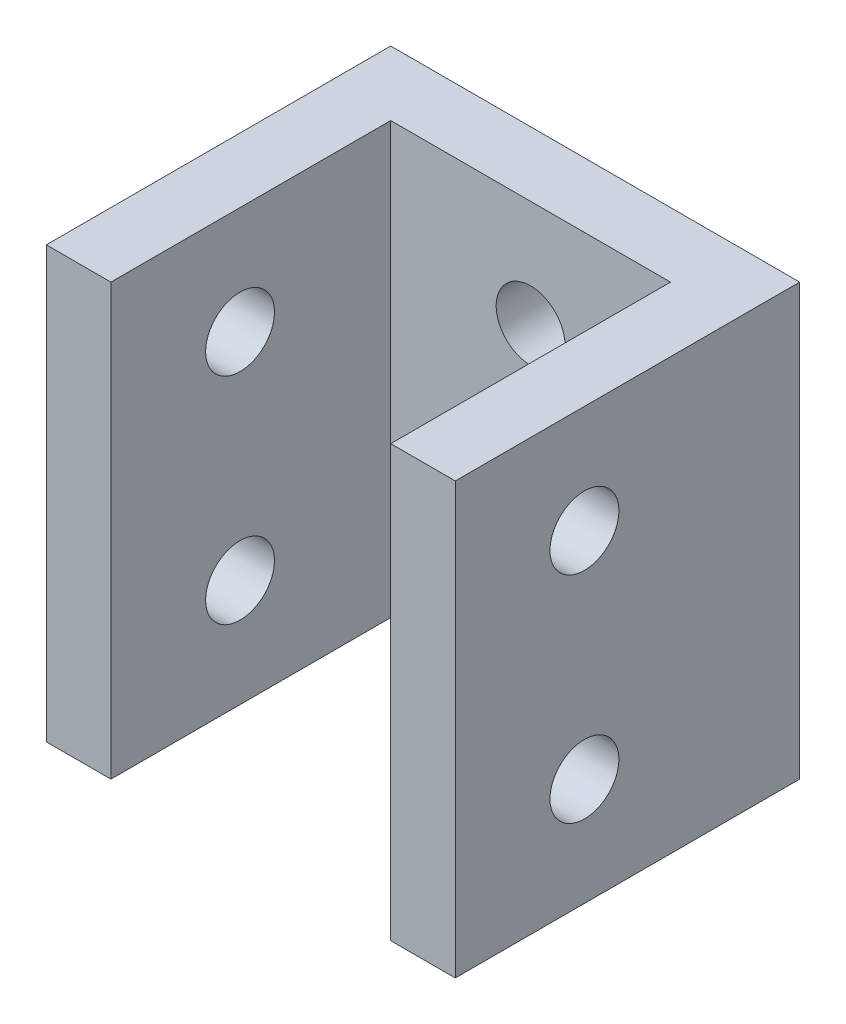
from build123d import *

# Parameters (mm, degrees)
SKETCH_1_W          = 19
SKETCH_1_H          = 20
EXTRUDE_1_DEPTH     = 3
SKETCH_2_W          = 3
SKETCH_2_H          = 20
EXTRUDE_2_DEPTH     = 15
SKETCH_3_R          = 1.6
CUT_EXTRUDE_1_DEPTH = 30
SKETCH_4_R          = 1.6
CUT_EXTRUDE_2_DEPTH = 30
SKETCH_5_W          = 9.97361981
SKETCH_5_H          = 25.467578512
CUT_EXTRUDE_3_DEPTH = 29


with BuildPart() as part:
    # 草图1 → 凸台-拉伸1 (new body)
    with BuildSketch(Plane.XY):
        with Locations((263.488347113, -53.108866795)):
            Rectangle(SKETCH_1_W, SKETCH_1_H)
    extrude(amount=EXTRUDE_1_DEPTH)

    # 草图2 → 凸台-拉伸2 (add)
    with BuildSketch(Plane.XY.offset(3)):
        with Locations((255.488347113, -53.108866795)):
            Rectangle(SKETCH_2_W, SKETCH_2_H)
        with Locations((271.488347113, -53.108866795)):
            Rectangle(SKETCH_2_W, SKETCH_2_H)
    extrude(amount=EXTRUDE_2_DEPTH)

    # 草图3 → 切除-拉伸1 (cut)
    with BuildSketch(Plane.ZY.offset(-253.988347113)):
        with Locations((10, -48.108866795)):
            Circle(SKETCH_3_R)
        with Locations((10, -58.108866795)):
            Circle(SKETCH_3_R)
    extrude(amount=-CUT_EXTRUDE_1_DEPTH, mode=Mode.SUBTRACT)

    # 草图4 → 切除-拉伸2 (cut)
    with BuildSketch(Plane.XY.offset(3)):
        with Locations((263.488347113, -48.108866795)):
            Circle(SKETCH_4_R)
        with Locations((263.488347113, -58.108866795)):
            Circle(SKETCH_4_R)
    extrude(amount=-CUT_EXTRUDE_2_DEPTH, mode=Mode.SUBTRACT)

    # 草图5 → 切除-拉伸3 (cut)
    with BuildSketch(Plane.ZY.offset(-253.988347113)):
        with Locations((20.986809905, -55.842656051)):
            Rectangle(SKETCH_5_W, SKETCH_5_H)
    extrude(amount=-CUT_EXTRUDE_3_DEPTH, mode=Mode.SUBTRACT)


solid = part.part
